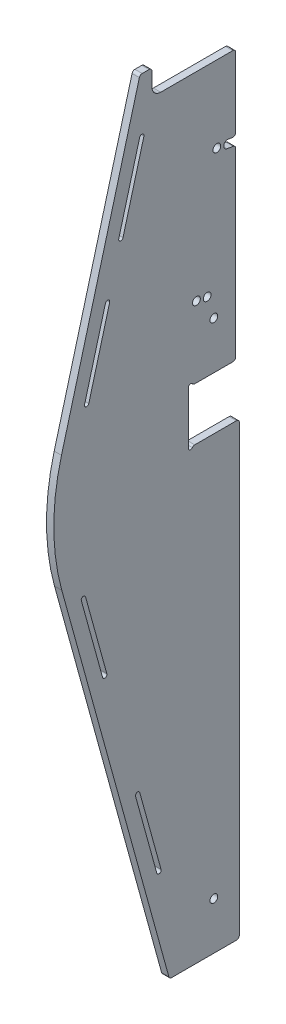
from build123d import *

# Parameters (mm, degrees)
BOSS_EXTRUDE1_DEPTH     = 6.35
F_1_4_CLEARANCE_HOLE1_D = 6.7564
CUT_EXTRUDE1_DEPTH      = 679.542476995
SKETCH9_R               = 1.905
CUT_EXTRUDE2_DEPTH      = 679.542476995
BOSS_EXTRUDE2_DEPTH     = 6.35
FILLET1_R               = 2.54
FILLET2_R               = 7.62


with BuildPart() as part:
    # Sketch4 → Boss-Extrude1 (new body)
    with BuildSketch(Plane(origin=(0, 0, 0), x_dir=(0, 0, -1), z_dir=(1, 0, 0))):
        with BuildLine():
            Line((31.75, -280.9875), (76.2, -280.9875))
            Line((76.2, -280.9875), (76.2, -673.1))
            Line((76.2, -673.1), (31.75, -673.1))
            Line((31.75, -673.1), (15.282303513, -673.1))
            Line((15.282303513, -673.1), (-78.562742141, -332.832245873))
            ThreePointArc((-78.562742141, -332.832245873), (-85.532748147, -281.837746657), (-78.825143864, -230.808069226))
            Line((-78.825143864, -230.808069226), (-16.444584614, 0))
            Line((-16.444584614, 0), (0, 0))
            Line((0, 0), (73.025, 0))
            Line((73.025, 0), (73.025, -234.95))
            Line((73.025, -234.95), (31.75, -234.95))
            Line((31.75, -234.95), (31.75, -280.9875))
        make_face()
        with BuildLine():
            Line((-28.901727688, -92.33360131), (-10.677232282, -24.902968307))
            ThreePointArc((-10.677232282, -24.902968307), (-8.341183326, -23.560982736), (-6.999197755, -25.897031693))
            Line((-6.999197755, -25.897031693), (-25.223693161, -93.327664696))
            ThreePointArc((-25.223693161, -93.327664696), (-27.559742118, -94.669650267), (-28.901727688, -92.33360131))
        make_face(mode=Mode.SUBTRACT)
        with BuildLine():
            Line((-42.977227606, -416.480766903), (-61.548336892, -349.144770587))
            ThreePointArc((-61.548336892, -349.144770587), (-60.218385428, -346.801849525), (-57.875464366, -348.13180099))
            Line((-57.875464366, -348.13180099), (-39.304355079, -415.467797306))
            ThreePointArc((-39.304355079, -415.467797306), (-40.634306544, -417.810718368), (-42.977227606, -416.480766903))
        make_face(mode=Mode.SUBTRACT)
        with BuildLine():
            Line((7.967559467, -586.868515201), (-10.603549819, -519.532518885))
            ThreePointArc((-10.603549819, -519.532518885), (-12.946470881, -518.202567421), (-14.276422345, -520.545488483))
            Line((-14.276422345, -520.545488483), (4.294686941, -587.881484799))
            ThreePointArc((4.294686941, -587.881484799), (6.637608003, -589.211436263), (7.967559467, -586.868515201))
        make_face(mode=Mode.SUBTRACT)
        with BuildLine():
            Line((-58.723629262, -202.674637133), (-40.499133856, -135.24400413))
            ThreePointArc((-40.499133856, -135.24400413), (-38.163084899, -133.902018559), (-36.821099329, -136.238067516))
            Line((-36.821099329, -136.238067516), (-55.045594735, -203.668700519))
            ThreePointArc((-55.045594735, -203.668700519), (-57.381643691, -205.01068609), (-58.723629262, -202.674637133))
        make_face(mode=Mode.SUBTRACT)
    extrude(amount=BOSS_EXTRUDE1_DEPTH)

    # 1/4 Clearance Hole1 (through all)
    with Locations(Plane(origin=(6.35, 0, 0), x_dir=(0, 0, -1), z_dir=(1, 0, 0))):
        with Locations((53.975, -631.825), (53.975, -193.675), (48.181629833, -174.671224416), (38.787102693, -173.100083168), (56.593370167, -66.628775584)):
            Hole(F_1_4_CLEARANCE_HOLE1_D / 2)

    # Sketch7 → Cut-Extrude1 (cut, through all)
    with BuildSketch(Plane(origin=(6.35, 0, 0), x_dir=(0, 0, -1), z_dir=(1, 0, 0))):
        with BuildLine():
            Line((73.025, -72.801919324), (65.430665878, -71.531842458))
            ThreePointArc((65.430665878, -71.531842458), (62.655971682, -67.642685403), (66.545128736, -64.867991206))
            Line((66.545128736, -64.867991206), (73.025, -65.951685241))
            Line((73.025, -65.951685241), (73.025, -72.801919324))
        make_face()
    extrude(amount=-CUT_EXTRUDE1_DEPTH, mode=Mode.SUBTRACT)

    # Sketch9 → Cut-Extrude2 (cut, through all)
    with BuildSketch(Plane(origin=(6.35, 0, 0), x_dir=(0, 0, -1), z_dir=(1, 0, 0))):
        with Locations((33.655, -234.95)):
            Circle(SKETCH9_R)
        with Locations((33.655, -280.9875)):
            Circle(SKETCH9_R)
    extrude(amount=-CUT_EXTRUDE2_DEPTH, mode=Mode.SUBTRACT)

    # Sketch10 → Boss-Extrude2 (add)
    with BuildSketch(Plane(origin=(6.35, 0, 0), x_dir=(0, 0, -1), z_dir=(1, 0, 0))):
        Polygon((0, 0), (0, 22.225), (-10.437827857, 22.225), (-16.444584614, 0), align=None)
    extrude(amount=-BOSS_EXTRUDE2_DEPTH)

    # Fillet1
    fillet1_edges = [part.edges().sort_by_distance(p)[0] for p in [
        (3.175, -65.951685241, -73.025),
        (3.175, -72.801919324, -73.025),
        (3.175, -280.9875, -35.56),
        (3.175, -234.95, -35.56),
        (3.175, 22.225, 10.437827857),
        (3.175, 22.225, 0),
        (3.175, -280.9875, -76.2),
        (3.175, -673.1, -76.2),
        (3.175, -673.1, -15.282303513),
        (3.175, 0, -73.025),
        (3.175, -234.95, -73.025),
    ]]
    fillet(fillet1_edges, radius=FILLET1_R)

    # Fillet2
    fillet2_edges = [part.edges().sort_by_distance(p)[0] for p in [
        (3.175, 0, 0),
    ]]
    fillet(fillet2_edges, radius=FILLET2_R)


solid = part.part
